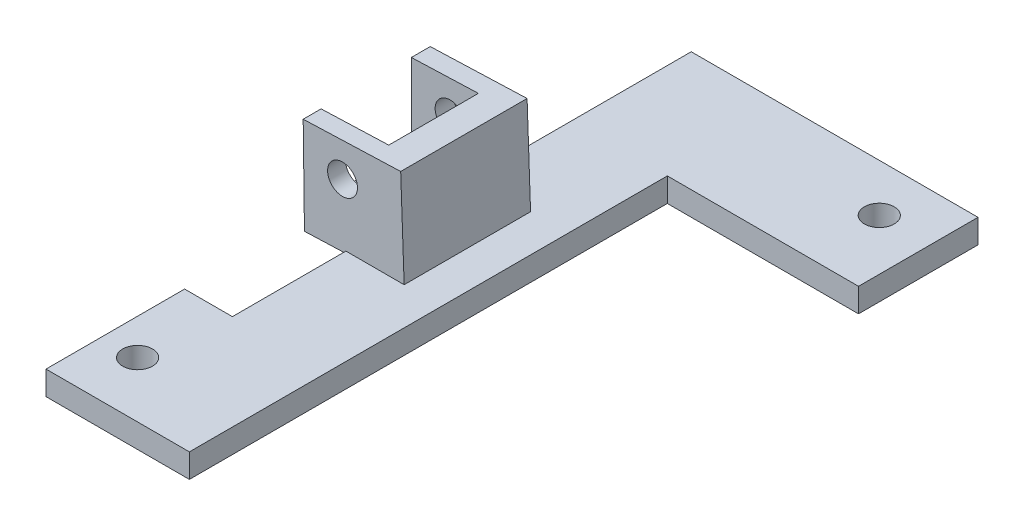
from build123d import *

# Parameters (mm, degrees)
BOSS_EXTRUDE2_DEPTH = 23.061761584
BOSS_EXTRUDE3_START = -4.011761584
SKETCH5_R           = 3.175
BOSS_EXTRUDE3_DEPTH = 4.011761584
BOSS_EXTRUDE5_START = 3.81
SKETCH6_R           = 3.175
BOSS_EXTRUDE5_DEPTH = 3.81
SKETCH7_R           = 3.175
BOSS_EXTRUDE6_DEPTH = 5.08


with BuildPart() as part:
    # Sketch1 → Boss-Extrude2 (new body)
    with BuildSketch(Plane.XY):
        with BuildLine():
            Line((346.486451601, 100.481133449), (337.915550261, 100.173402481))
            Line((337.915550261, 100.173402481), (338.052257003, 96.365855861))
            Line((338.052257003, 96.365855861), (359.243555017, 97.126711503))
            Line((359.243555017, 97.126711503), (358.508072741, 117.611312321))
            Line((358.508072741, 117.611312321), (352.162161707, 117.383467749))
            ThreePointArc((352.162161707, 117.383467749), (355.663551295, 110.341766857), (352.67617906, 103.067092457))
            ThreePointArc((352.67617906, 103.067092457), (349.816499797, 101.211177598), (346.486451601, 100.481133449))
        make_face()
    extrude(amount=-BOSS_EXTRUDE2_DEPTH)

    # Sketch5 → Boss-Extrude3 (add)
    with BuildSketch(Plane(origin=(0, 0, -23.061761584), x_dir=(-1, 0, 0), z_dir=(0, 0, -1)).offset(BOSS_EXTRUDE3_START)):
        with BuildLine():
            Line((-337.915550261, 116.871955208), (-337.915550261, 100.173402481))
            Line((-337.915550261, 100.173402481), (-346.486451601, 100.481133449))
            ThreePointArc((-346.486451601, 100.481133449), (-355.174204205, 106.967937449), (-352.162161707, 117.383467749))
            Line((-352.162161707, 117.383467749), (-337.915550261, 116.871955208))
        make_face()
        with Locations((-346.144684744, 110)):
            Circle(SKETCH5_R, mode=Mode.SUBTRACT)
    extrude(amount=BOSS_EXTRUDE3_DEPTH)

    # Sketch6 → Boss-Extrude5 (add)
    with BuildSketch(Plane.XY.offset(BOSS_EXTRUDE5_START)):
        Polygon((337.780813741, 116.867117607), (338.052257003, 96.365855861), (359.243555017, 97.126711503), (358.508072741, 117.611312321), align=None)
        with Locations(Location((346.144684744, 110, 0), (0, 0, 180))):
            Circle(SKETCH6_R, mode=Mode.SUBTRACT)
    extrude(amount=-BOSS_EXTRUDE5_DEPTH)

    # Sketch7 → Boss-Extrude6 (add)
    with BuildSketch(Plane(origin=(0, 97.126711503, 0), x_dir=(1, 0, 0), z_dir=(0, 1, 0))):
        Polygon((367.184506183, -32.004), (367.184506183, -57.404), (336.704506183, -57.404), (336.704506183, -27.94), (346.864506183, -27.94), (346.864506183, 44.958), (346.864506183, 69.596), (407.824506183, 69.596), (407.824506183, 44.196), (367.184506183, 44.196), align=None)
        with Locations(Location((396.977487406, 59.456782771, 0), (0, 0, 270))):
            Circle(SKETCH7_R, mode=Mode.SUBTRACT)
        with Locations(Location((344.324506183, -45.552790878, 0), (0, 0, 270))):
            Circle(SKETCH7_R, mode=Mode.SUBTRACT)
    extrude(amount=-BOSS_EXTRUDE6_DEPTH)


solid = part.part
